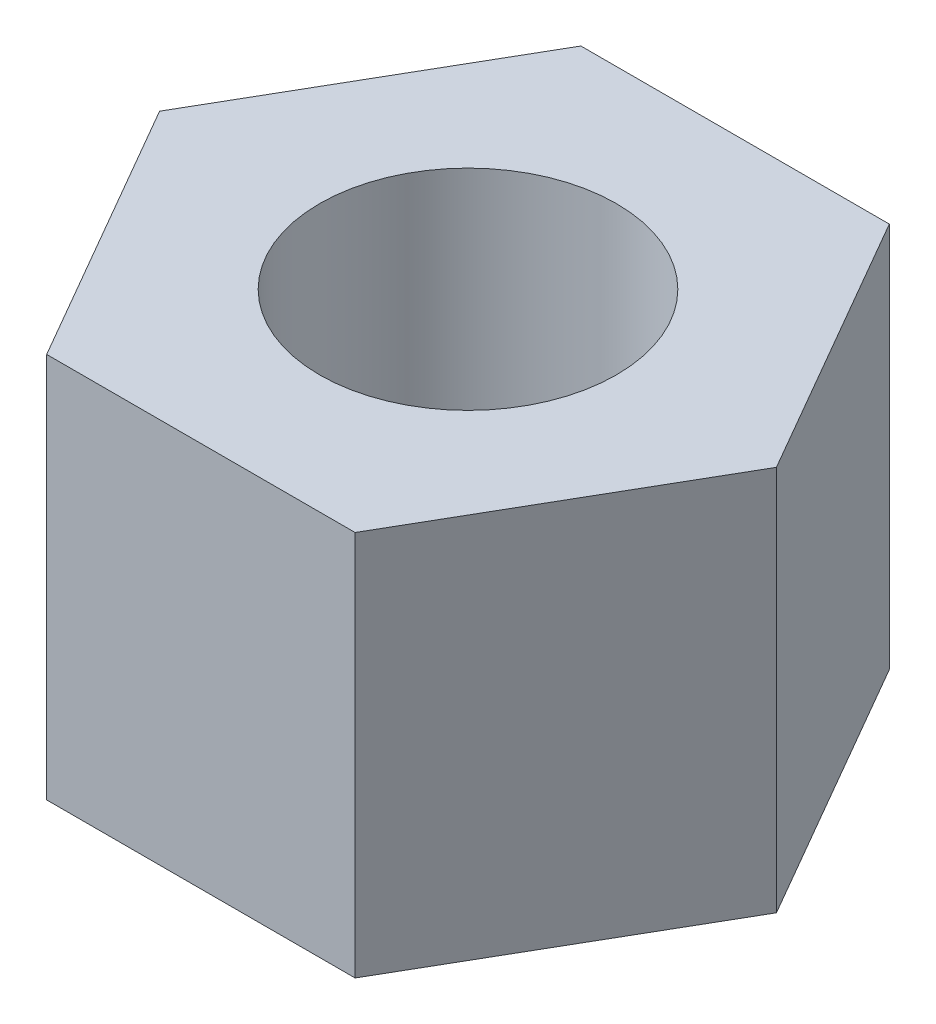
from build123d import *

# Parameters (mm, degrees)
CROQUIS1_R              = 1.5
SALIENTE_EXTRUIR1_DEPTH = 3.9


with BuildPart() as part:
    # Croquis1 → Saliente-Extruir1 (new body)
    with BuildSketch(Plane(origin=(0, 0, 0), x_dir=(1, 0, 0), z_dir=(0, 1, 0))):
        Polygon((3.117691454, 0), (1.558845727, 2.7), (-1.558845727, 2.7), (-3.117691454, 0), (-1.558845727, -2.7), (1.558845727, -2.7), align=None)
        with Locations(Location((0, 0, 0), (0, 0, 270))):
            Circle(CROQUIS1_R, mode=Mode.SUBTRACT)
    extrude(amount=SALIENTE_EXTRUIR1_DEPTH)


solid = part.part
